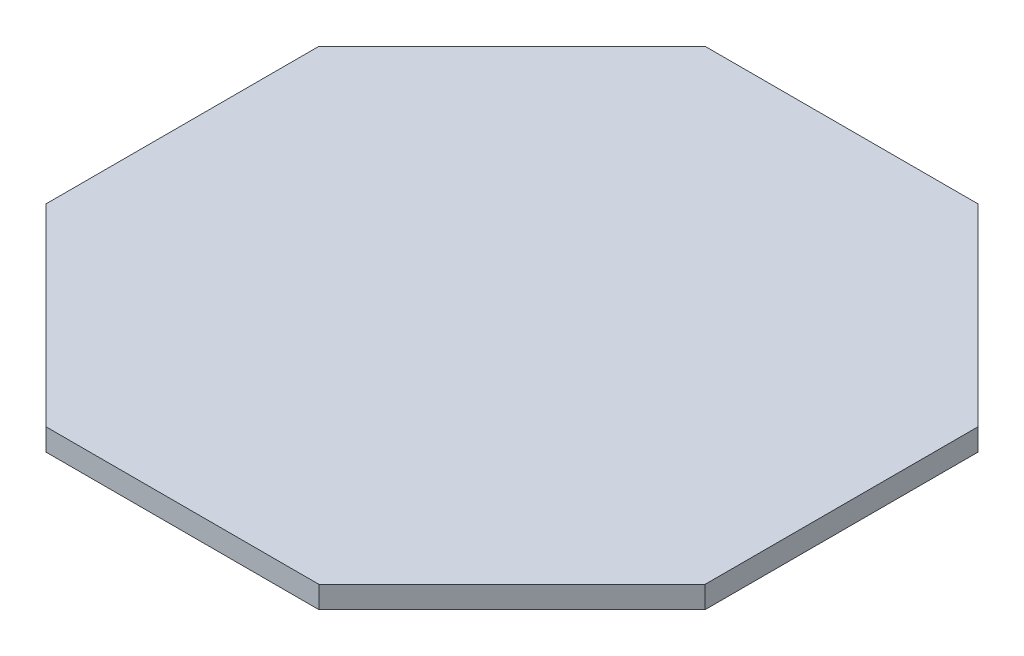
from build123d import *

# Parameters (mm, degrees)
BOSS_EXTRUDE1_DEPTH = 10


with BuildPart() as part:
    # Sketch1 → Boss-Extrude1 (new body)
    with BuildSketch(Plane(origin=(0, 0, 0), x_dir=(1, 0, 0), z_dir=(0, 1, 0))):
        Polygon((150, -62.132034356), (150, 62.132034356), (62.132034356, 150), (-62.132034356, 150), (-150, 62.132034356), (-150, -62.132034356), (-62.132034356, -150), (62.132034356, -150), align=None)
    extrude(amount=BOSS_EXTRUDE1_DEPTH)


solid = part.part
